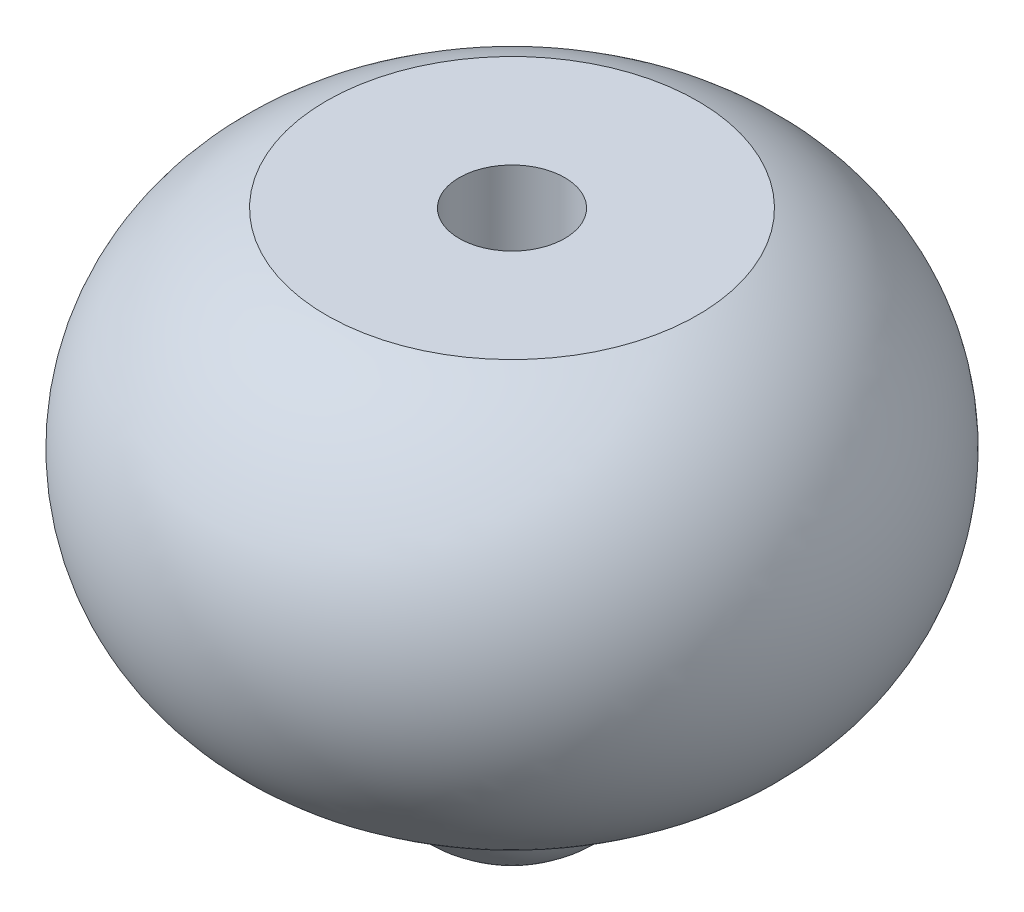
from build123d import *

# Parameters (mm, degrees)
CUT_EXTRUDE1_DEPTH      = 25.4
CUT_EXTRUDE1_DEPTH_BACK = 2.54
SKETCH2_R               = 4.7625


with BuildPart() as part:
    # Sketch1 → Revolve1 (revolve)
    with BuildSketch(Plane.XY):
        with BuildLine():
            Line((67.16661055, 0.265155182), (67.166176664, 49.247497553))
            Line((67.166176664, 49.247497553), (50.414248194, 49.247497553))
            ThreePointArc((50.414248194, 49.247497553), (37.651982709, 27.402644994), (56.428189658, 10.44602221))
            ThreePointArc((56.428189658, 10.44602221), (59.767872764, 3.214914554), (67.16661055, 0.265155182))
        make_face()
    revolve(axis=Axis((67.16661055, 0.265155182, 0), (-8.858023600172911e-06, 0.9999999999607677, 0)))

    # Sketch2 → Cut-Extrude1 (cut, two sides: drawn at the far end of the back side and taken through both)
    with BuildSketch(Plane(origin=(-0.000436232, 49.247050978, 0), x_dir=(-0.9999999999607678, -8.858023600354276e-06, 0), z_dir=(8.858023600354276e-06, -0.9999999999607678, 0)).offset(-CUT_EXTRUDE1_DEPTH_BACK)):
        with Locations((-67.166612896, 0)):
            Circle(SKETCH2_R)
    extrude(amount=CUT_EXTRUDE1_DEPTH + CUT_EXTRUDE1_DEPTH_BACK, mode=Mode.SUBTRACT)


solid = part.part
